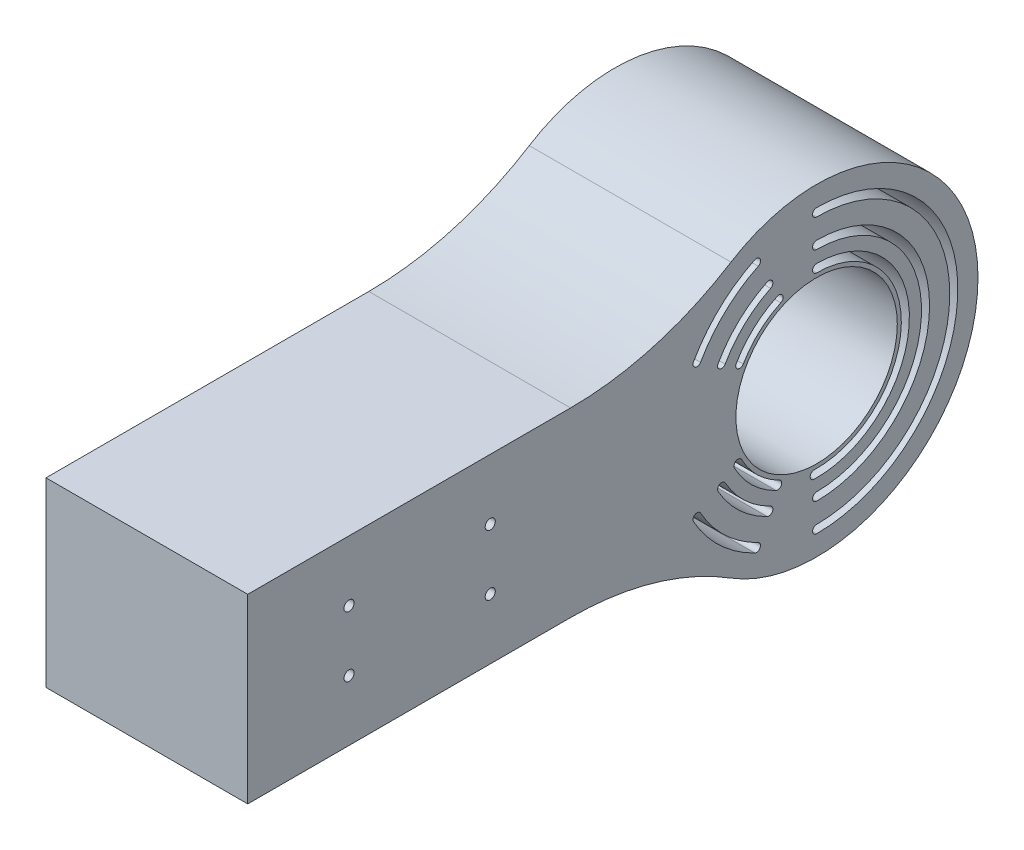
from build123d import *

# Parameters (mm, degrees)
ESBO_O2_R                = 20
RESSALTO_EXTRUS_O1_DEPTH = 25
ESBO_O3_R                = 1.25
CORTE_EXTRUS_O1_DEPTH    = 145.913767462


with BuildPart() as part:
    # Esboço2 → Ressalto-extrusão1 (new, symmetric)
    with BuildSketch(Plane(origin=(0, 0, 0), x_dir=(0, 0, -1), z_dir=(1, 0, 0))):
        with BuildLine():
            Line((-50.981554588, -22.5), (29.018445412, -22.5))
            ThreePointArc((29.018445412, -22.5), (49.706343576, -25.409703361), (68.789024491, -33.913043478))
            ThreePointArc((68.789024491, -33.913043478), (130, 0), (68.789024491, 33.913043478))
            ThreePointArc((68.789024491, 33.913043478), (49.706343576, 25.409703361), (29.018445412, 22.5))
            Line((29.018445412, 22.5), (-50.981554588, 22.5))
            Line((-50.981554588, 22.5), (-50.981554588, -22.5))
        make_face()
        with Locations((90, 0)):
            Circle(ESBO_O2_R, mode=Mode.SUBTRACT)
        with BuildLine():
            ThreePointArc((67.339434728, -12.747500993), (72.162673174, -18.916388971), (78.603905138, -23.369403542))
            ThreePointArc((78.603905138, -23.369403542), (79.064417011, -24.706538096), (77.727282457, -25.167049968))
            ThreePointArc((77.727282457, -25.167049968), (70.79057111, -20.371495815), (65.596314323, -13.728077992))
            ThreePointArc((65.596314323, -13.728077992), (65.977586026, -12.36622929), (67.339434728, -12.747500993))
        make_face(mode=Mode.SUBTRACT)
        with BuildLine():
            ThreePointArc((61.238513309, -16.179520491), (67.360315951, -24.009262924), (75.535725753, -29.661166034))
            ThreePointArc((75.535725753, -29.661166034), (75.996237625, -30.998300588), (74.659103071, -31.45881246))
            ThreePointArc((74.659103071, -31.45881246), (65.988213888, -25.464369768), (59.495392903, -17.16009749))
            ThreePointArc((59.495392903, -17.16009749), (59.876664606, -15.798248788), (61.238513309, -16.179520491))
        make_face(mode=Mode.SUBTRACT)
        with BuildLine():
            ThreePointArc((59.495392903, 17.16009749), (59.876664606, 15.798248788), (61.238513309, 16.179520491))
            ThreePointArc((61.238513309, 16.179520491), (67.360315951, 24.009262924), (75.535725753, 29.661166034))
            ThreePointArc((75.535725753, 29.661166034), (75.996237625, 30.998300588), (74.659103071, 31.45881246))
            ThreePointArc((74.659103071, 31.45881246), (65.988213888, 25.464369768), (59.495392903, 17.16009749))
        make_face(mode=Mode.SUBTRACT)
        with BuildLine():
            ThreePointArc((65.596314323, 13.728077992), (65.977586026, 12.36622929), (67.339434728, 12.747500993))
            ThreePointArc((67.339434728, 12.747500993), (72.162673174, 18.916388971), (78.603905138, 23.369403542))
            ThreePointArc((78.603905138, 23.369403542), (79.064417011, 24.706538096), (77.727282457, 25.167049968))
            ThreePointArc((77.727282457, 25.167049968), (70.79057111, 20.371495815), (65.596314323, 13.728077992))
        make_face(mode=Mode.SUBTRACT)
        with BuildLine():
            ThreePointArc((90, -35), (125, 0), (90, 35))
            ThreePointArc((90, 35), (89, 34), (90, 33))
            ThreePointArc((90, 33), (123, 0), (90, -33))
            ThreePointArc((90, -33), (89, -34), (90, -35))
        make_face(mode=Mode.SUBTRACT)
        with BuildLine():
            ThreePointArc((90, -28), (118, 0), (90, 28))
            ThreePointArc((90, 28), (89, 27), (90, 26))
            ThreePointArc((90, 26), (116, 0), (90, -26))
            ThreePointArc((90, -26), (89, -27), (90, -28))
        make_face(mode=Mode.SUBTRACT)
        with BuildLine():
            ThreePointArc((80.278403844, 20.844437344), (74.464540757, 16.960233079), (70.086402165, 11.508632467))
            ThreePointArc((70.086402165, 11.508632467), (70.451835442, 10.142448541), (71.818019368, 10.507881818))
            ThreePointArc((71.818019368, 10.507881818), (75.815450256, 15.485430203), (81.123760031, 19.031877575))
            ThreePointArc((81.123760031, 19.031877575), (81.607361822, 20.360835553), (80.278403844, 20.844437344))
        make_face(mode=Mode.SUBTRACT)
        with BuildLine():
            ThreePointArc((69.641858511, -10.702620013), (73.984708204, -16.507889892), (79.918839161, -20.672933902))
            ThreePointArc((79.918839161, -20.672933902), (81.255973715, -20.21242203), (80.795461843, -18.875287476))
            ThreePointArc((80.795461843, -18.875287476), (75.377342273, -15.072421206), (71.412131684, -9.771957403))
            ThreePointArc((71.412131684, -9.771957403), (70.061663793, -9.352152121), (69.641858511, -10.702620013))
        make_face(mode=Mode.SUBTRACT)
        with BuildLine():
            ThreePointArc((89.378360714, -22.991597696), (112.997899328, -0.310848034), (90, 23))
            ThreePointArc((90, 23), (89, 22), (90, 21))
            ThreePointArc((90, 21), (110.998081995, -0.28381777), (89.432416304, -20.992328331))
            ThreePointArc((89.432416304, -20.992328331), (88.405753826, -21.964935218), (89.378360714, -22.991597696))
        make_face(mode=Mode.SUBTRACT)
    extrude(amount=RESSALTO_EXTRUS_O1_DEPTH, both=True)

    # Esboço3 → Corte-extrusão1 (cut, through all)
    with BuildSketch(Plane.ZY.offset(25)):
        with Locations((25.881554588, 7.5)):
            Circle(ESBO_O3_R)
        with Locations((-9.118445412, 7.5)):
            Circle(ESBO_O3_R)
        with Locations((-9.118445412, -7.5)):
            Circle(ESBO_O3_R)
        with Locations((25.881554588, -7.5)):
            Circle(ESBO_O3_R)
    extrude(amount=-CORTE_EXTRUS_O1_DEPTH, mode=Mode.SUBTRACT)


solid = part.part
